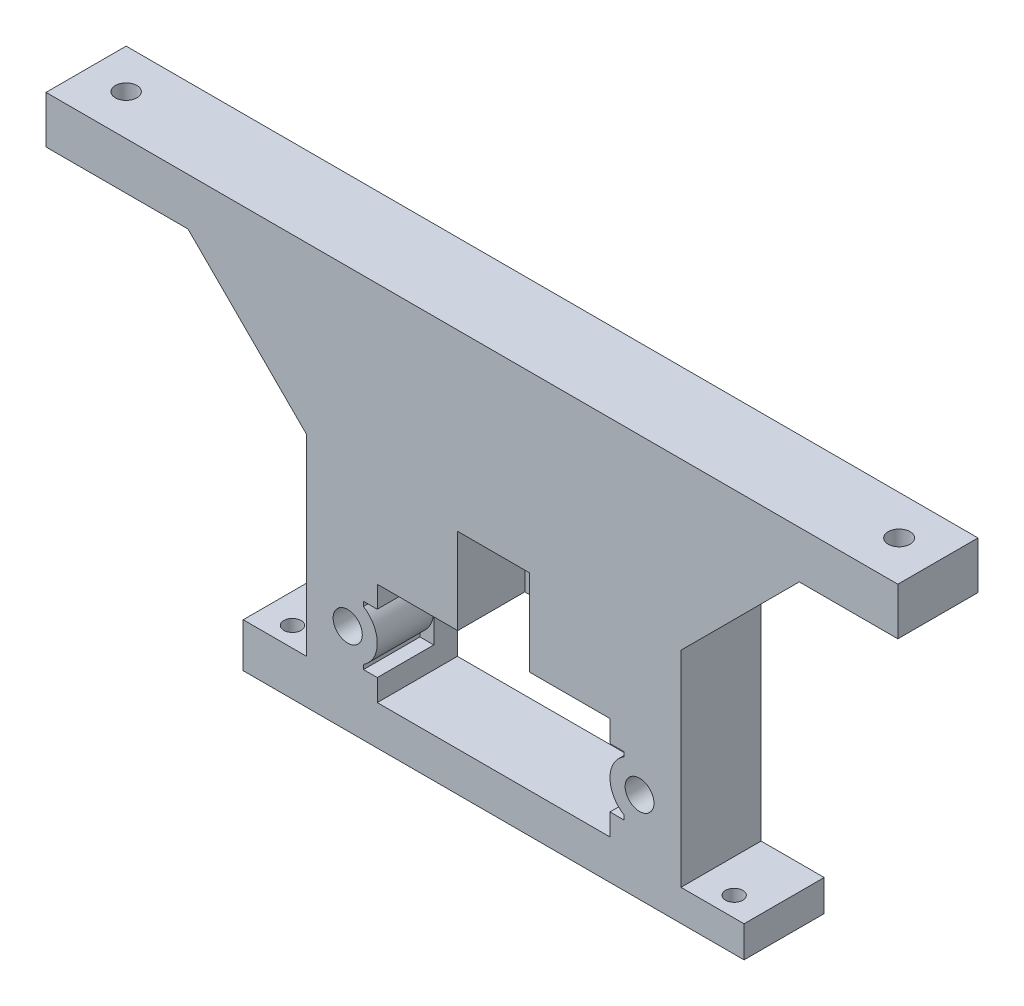
from build123d import *

# Parameters (mm, degrees)
SKETCH1_W               = 63.5
SKETCH1_H               = 10.16
BOSS_EXTRUDE1_DEPTH     = 51
SKETCH2_R               = 1.0922
CUT_EXTRUDE1_DEPTH      = 10
CUT_EXTRUDE2_DEPTH      = 83.076035479
CUT_EXTRUDE2_DEPTH_BACK = 83.076035479
SKETCH3_W               = 8
SKETCH3_H               = 47.710038991
SKETCH3_H_2             = 48.198954848
SKETCH5_W               = 33
SKETCH5_H               = 10.16
SKETCH5_R               = 1.363261963
SKETCH5_W_2             = 27.5
SKETCH5_R_2             = 1.386126721
BOSS_EXTRUDE2_DEPTH     = 6
CHAMFER2_SIZE           = 15
CUT_EXTRUDE3_DEPTH      = 98.945013145
CUT_EXTRUDE3_DEPTH_BACK = 98.945013145
SKETCH6_W               = 9.1
SKETCH6_H               = 10.9
SKETCH6_R               = 1.849544376
SKETCH6_R_2             = 1.82922697
SKETCH7_W               = 9.1
SKETCH7_H               = 10.9
BOSS_EXTRUDE3_DEPTH     = 1.66
SKETCH8_W               = 1.75
SKETCH8_H               = 7.5
BOSS_EXTRUDE4_DEPTH     = 3


with BuildPart() as part:
    # Sketch1 → Boss-Extrude1 (new body)
    with BuildSketch(Plane(origin=(0, 0, 0), x_dir=(1, 0, 0), z_dir=(0, 1, 0))):
        with Locations((31.75, 5.08)):
            Rectangle(SKETCH1_W, SKETCH1_H)
    extrude(amount=BOSS_EXTRUDE1_DEPTH)

    # Sketch2 → Cut-Extrude1 (cut)
    with BuildSketch(Plane(origin=(0, 0, 0), x_dir=(-1, 0, 0), z_dir=(0, -1, 0))):
        with Locations(Location((-59.75, 2.5, 0), (0, 0, 90))):
            Circle(SKETCH2_R)
        with Locations(Location((-3.75, 2.5, 0), (0, 0, 90))):
            Circle(SKETCH2_R)
    extrude(amount=-CUT_EXTRUDE1_DEPTH, mode=Mode.SUBTRACT)

    # Sketch3 → Cut-Extrude2 (cut, two sides: drawn at the far end of the back side and taken through both)
    with BuildSketch(Plane.XY.offset(-CUT_EXTRUDE2_DEPTH_BACK)):
        with Locations((4, 29.452019142)):
            Rectangle(SKETCH3_W, SKETCH3_H)
        with Locations((59.5, 28.066757549)):
            Rectangle(SKETCH3_W, SKETCH3_H_2)
    extrude(amount=CUT_EXTRUDE2_DEPTH + CUT_EXTRUDE2_DEPTH_BACK, mode=Mode.SUBTRACT)

    # Sketch5 → Boss-Extrude2 (add)
    # profile 1 of 2: a face of its own
    with BuildSketch(Plane(origin=(0, 51, 0), x_dir=(1, 0, 0), z_dir=(0, 1, 0))):
        with Locations((-8.5, 5.08)):
            Rectangle(SKETCH5_W, SKETCH5_H)
        with Locations(Location((-20, 5.16, 0), (0, 0, 270))):
            Circle(SKETCH5_R, mode=Mode.SUBTRACT)
    # profile 2 of 2: a face of its own
    with BuildSketch(Plane(origin=(0, 51, 0), x_dir=(1, 0, 0), z_dir=(0, 1, 0))):
        with Locations((69.25, 5.08)):
            Rectangle(SKETCH5_W_2, SKETCH5_H)
        with Locations(Location((78, 5.16, 0), (0, 0, 270))):
            Circle(SKETCH5_R_2, mode=Mode.SUBTRACT)
    extrude(amount=-BOSS_EXTRUDE2_DEPTH)

    # Chamfer2
    chamfer2_edges = [part.edges().sort_by_distance(p)[0] for p in [
        (8, 45, -5.08),
        (55.5, 45, -5.08),
    ]]
    chamfer(chamfer2_edges, length=CHAMFER2_SIZE)

    # Sketch6 → Cut-Extrude3 (cut, two sides: drawn at the far end of the back side and taken through both)
    with BuildSketch(Plane.XY.offset(-CUT_EXTRUDE3_DEPTH_BACK)):
        with Locations((31.75, 23.45)):
            Rectangle(SKETCH6_W, SKETCH6_H)
        Polygon((27.2, 18), (17, 18), (17, 15.25), (17, 11.5), (17, 7.75), (17, 5), (46.5, 5), (46.5, 7.75), (46.5, 11.5), (46.5, 15.25), (46.5, 18), (36.3, 18), align=None)
        with BuildLine():
            Line((17, 11.5), (17, 15.25))
            Line((17, 15.25), (15.25, 15.25))
            Line((15.25, 15.25), (15.25, 14.672144385))
            ThreePointArc((15.25, 14.672144385), (16.533481384, 13.311422093), (17, 11.5))
        make_face()
        with BuildLine():
            Line((17, 7.75), (17, 11.5))
            ThreePointArc((17, 11.5), (16.533481384, 9.688577907), (15.25, 8.327855615))
            Line((15.25, 8.327855615), (15.25, 7.75))
            Line((15.25, 7.75), (17, 7.75))
        make_face()
        with Locations((13.25, 11.5)):
            Circle(SKETCH6_R)
        with Locations((50.25, 11.5)):
            Circle(SKETCH6_R_2)
        with BuildLine():
            Line((48.25, 15.25), (46.5, 15.25))
            Line((46.5, 15.25), (46.5, 11.5))
            ThreePointArc((46.5, 11.5), (46.966518616, 13.311422093), (48.25, 14.672144385))
            Line((48.25, 14.672144385), (48.25, 15.25))
        make_face()
        with BuildLine():
            ThreePointArc((48.25, 8.327855615), (46.966518616, 9.688577907), (46.5, 11.5))
            Line((46.5, 11.5), (46.5, 7.75))
            Line((46.5, 7.75), (48.25, 7.75))
            Line((48.25, 7.75), (48.25, 8.327855615))
        make_face()
    extrude(amount=CUT_EXTRUDE3_DEPTH + CUT_EXTRUDE3_DEPTH_BACK, mode=Mode.SUBTRACT)

    # Sketch7 → Boss-Extrude3 (add)
    with BuildSketch(Plane(origin=(0, 0, -10.16), x_dir=(-1, 0, 0), z_dir=(0, 0, -1))):
        with Locations((-31.75, 23.45)):
            Rectangle(SKETCH7_W, SKETCH7_H)
    extrude(amount=-BOSS_EXTRUDE3_DEPTH)

    # Sketch8 → Boss-Extrude4 (add)
    with BuildSketch(Plane(origin=(0, 0, -10.16), x_dir=(-1, 0, 0), z_dir=(0, 0, -1))):
        with Locations((-47.375, 11.5)):
            Rectangle(SKETCH8_W, SKETCH8_H)
        with Locations((-16.125, 11.5)):
            Rectangle(SKETCH8_W, SKETCH8_H)
    extrude(amount=-BOSS_EXTRUDE4_DEPTH)


solid = part.part
